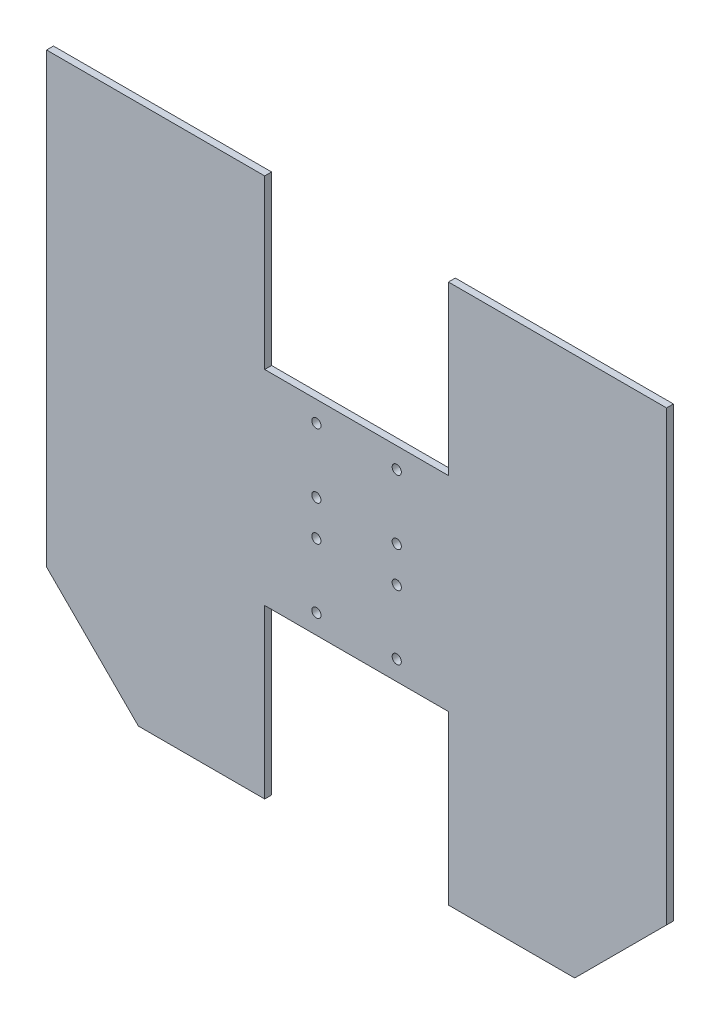
from build123d import *

# Parameters (mm, degrees)
BOSS_EXTRU_1_DEPTH      = 3
ESQUISSE2_R             = 2
ENL_V_MAT_EXTRU_1_DEPTH = 179.997905016
CHANFREIN1_SIZE         = 40


with BuildPart() as part:
    # Esquisse1 → Boss.-Extru.1 (new body)
    with BuildSketch(Plane.XY):
        Polygon((-40, 117.5), (-40, 44.5), (40, 44.5), (40, 117.5), (135, 117.5), (135, -117.5), (40, -117.5), (40, -44.5), (-40, -44.5), (-40, -117.5), (-135, -117.5), (-135, 117.5), align=None)
    extrude(amount=BOSS_EXTRU_1_DEPTH)

    # Esquisse2 → Enlèv. mat.-Extru.1 (cut, through all)
    with BuildSketch(Plane.XY.offset(3)):
        with Locations((-17.5, -35.98)):
            Circle(ESQUISSE2_R)
        with Locations((17.5, -35.98)):
            Circle(ESQUISSE2_R)
        with Locations((-17.5, -7.98)):
            Circle(ESQUISSE2_R)
        with Locations((-17.5, 7.5)):
            Circle(ESQUISSE2_R)
        with Locations((17.5, 7.5)):
            Circle(ESQUISSE2_R)
        with Locations((17.5, -7.98)):
            Circle(ESQUISSE2_R)
        with Locations((-17.5, 35.5)):
            Circle(ESQUISSE2_R)
        with Locations((17.5, 35.5)):
            Circle(ESQUISSE2_R)
    extrude(amount=-ENL_V_MAT_EXTRU_1_DEPTH, mode=Mode.SUBTRACT)

    # Chanfrein1
    chanfrein1_edges = [part.edges().sort_by_distance(p)[0] for p in [
        (135, -117.5, 1.5),
        (-135, -117.5, 1.5),
    ]]
    chamfer(chanfrein1_edges, length=CHANFREIN1_SIZE)


solid = part.part
